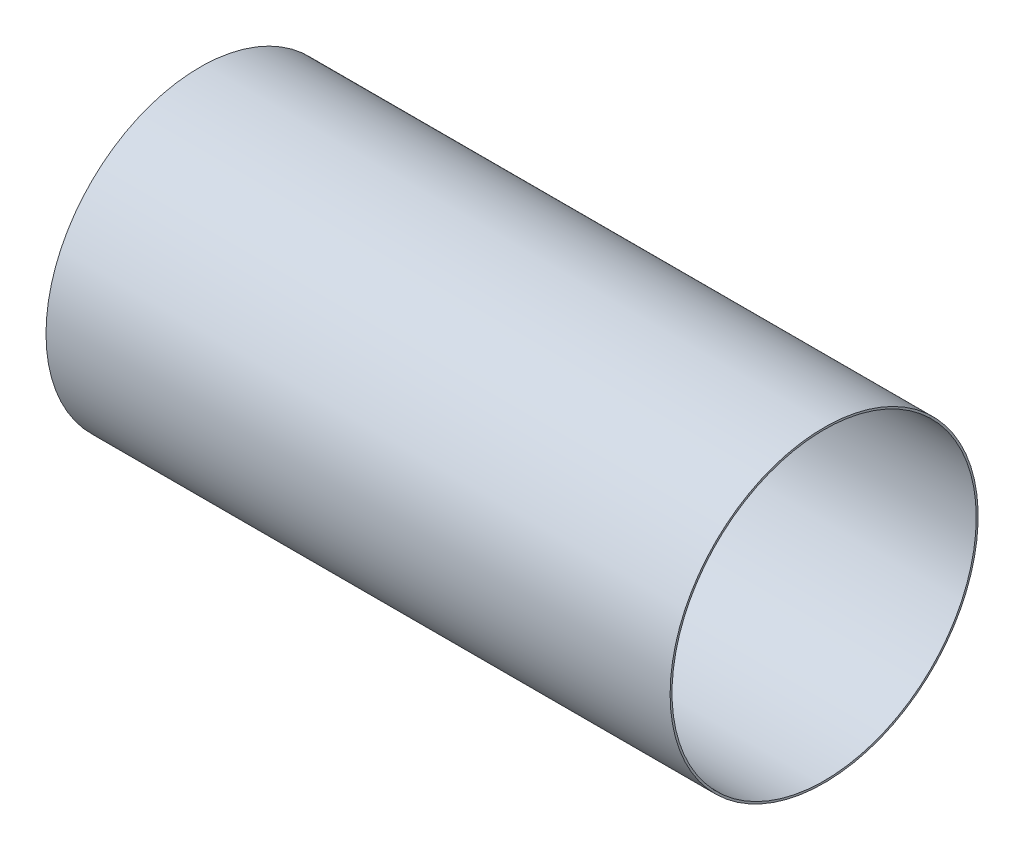
from build123d import *

# Parameters (mm, degrees)
SKETCH2_R           = 75.2221
BOSS_EXTRUDE1_DEPTH = 304.8
SKETCH3_R           = 74.2823
CUT_EXTRUDE1_DEPTH  = 323.830866952


with BuildPart() as part:
    # Sketch2 → Boss-Extrude1 (new body)
    with BuildSketch(Plane(origin=(0, 0, 0), x_dir=(0, 0, -1), z_dir=(1, 0, 0))):
        with Locations(Location((0, 0, 0), (0, 0, 180))):
            Circle(SKETCH2_R)
    extrude(amount=BOSS_EXTRUDE1_DEPTH)

    # Sketch3 → Cut-Extrude1 (cut, through all)
    with BuildSketch(Plane(origin=(304.8, 0, 0), x_dir=(0, 0, -1), z_dir=(1, 0, 0))):
        Circle(SKETCH3_R)
    extrude(amount=-CUT_EXTRUDE1_DEPTH, mode=Mode.SUBTRACT)


solid = part.part
